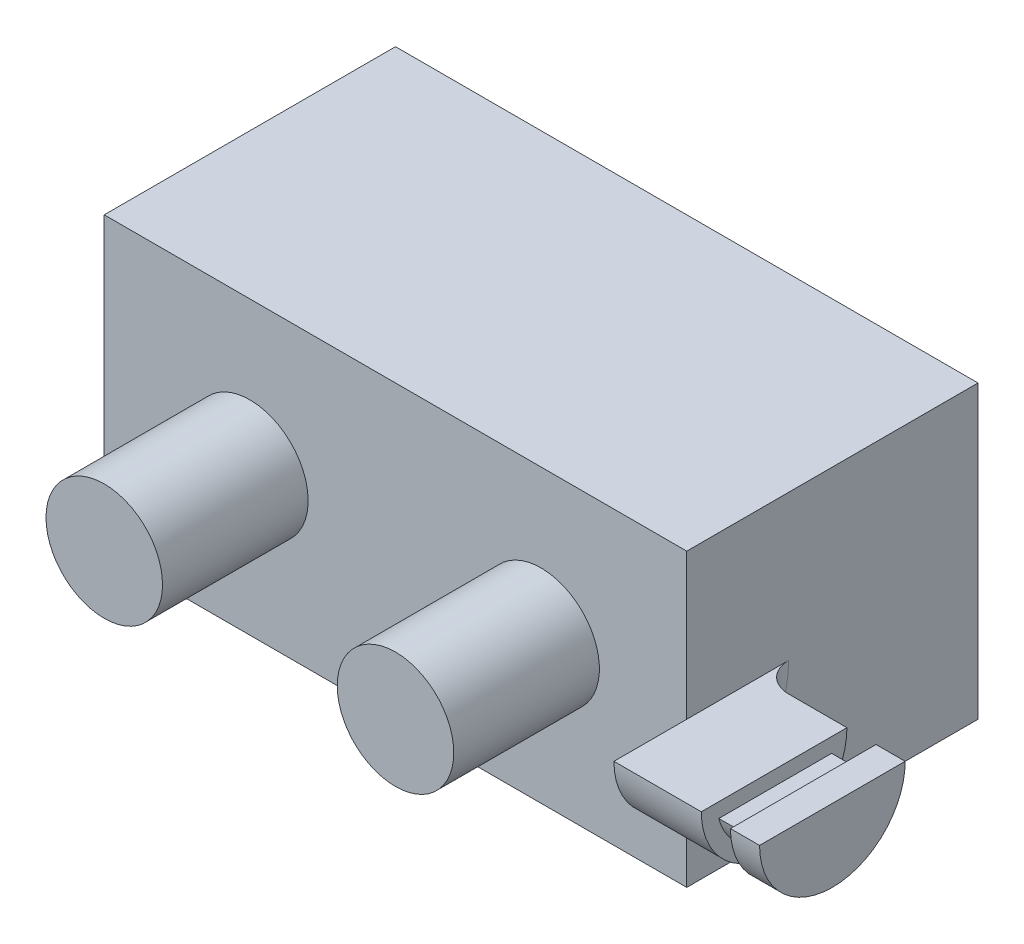
from build123d import *

# Parameters (mm, degrees)
SKETCH1_W           = 50.8
SKETCH1_H           = 25.4
BOSS_EXTRUDE2_DEPTH = 25.4
SKETCH3_R           = 5.08
BOSS_EXTRUDE3_DEPTH = 12.7
BOSS_EXTRUDE4_START = 50.8
BOSS_EXTRUDE4_DEPTH = 12.7
CUT_EXTRUDE1_START  = 58.42
CUT_EXTRUDE1_DEPTH  = 2.54
FILLET8_R           = 2.54


with BuildPart() as part:
    # Sketch1 → Boss-Extrude2 (new body)
    with BuildSketch(Plane(origin=(0, 0, 0), x_dir=(1, 0, 0), z_dir=(0, 1, 0))):
        with Locations((25.4, 12.7)):
            Rectangle(SKETCH1_W, SKETCH1_H)
    extrude(amount=BOSS_EXTRUDE2_DEPTH)

    # Sketch3 → Boss-Extrude3 (add)
    with BuildSketch(Plane.XY):
        with Locations(Location((12.7, 12.7, 0), (0, 0, 180))):
            Circle(SKETCH3_R)
        with Locations(Location((38.1, 12.7, 0), (0, 0, 180))):
            Circle(SKETCH3_R)
    extrude(amount=BOSS_EXTRUDE3_DEPTH)

    # Sketch4 → Boss-Extrude4 (add)
    with BuildSketch(Plane(origin=(0, 0, 0), x_dir=(0, 0, -1), z_dir=(1, 0, 0)).offset(BOSS_EXTRUDE4_START)):
        with BuildLine():
            Line((-6.35, 12.7), (6.35, 12.7))
            ThreePointArc((6.35, 12.7), (0, 6.35), (-6.35, 12.7))
        make_face()
    extrude(amount=BOSS_EXTRUDE4_DEPTH)

    # Sketch24 → Cut-Extrude1 (cut)
    with BuildSketch(Plane(origin=(0, 0, 0), x_dir=(0, 0, -1), z_dir=(1, 0, 0)).offset(CUT_EXTRUDE1_START)):
        with BuildLine():
            Line((-6.35, 12.7), (6.35, 12.7))
            ThreePointArc((6.35, 12.7), (0, 6.35), (-6.35, 12.7))
        make_face()
        with BuildLine():
            Line((-4.824854626, 11.43), (5.012523073, 11.43))
            ThreePointArc((5.012523073, 11.43), (0.093834223, 7.62), (-4.824854626, 11.43))
        make_face(mode=Mode.SUBTRACT)
    extrude(amount=CUT_EXTRUDE1_DEPTH, mode=Mode.SUBTRACT)

    # Fillet8
    fillet8_edges = [part.edges().sort_by_distance(p)[0] for p in [
        (50.8, 8.209871939, -4.490128061),
    ]]
    fillet(fillet8_edges, radius=FILLET8_R)


solid = part.part
